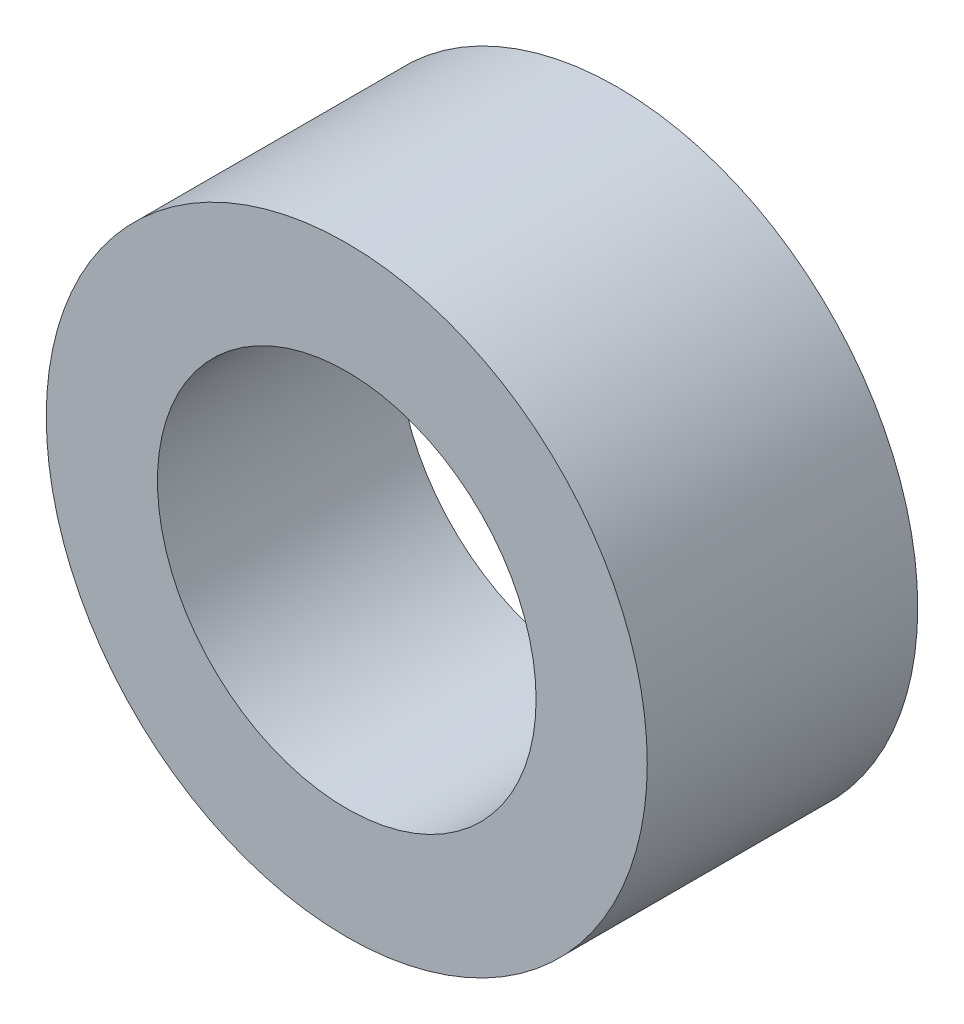
from build123d import *

# Parameters (mm, degrees)
SKETCH1_R          = 10
EXTRUDE1_DEPTH     = 8
EXTRUDE2_START     = 1
SKETCH3_R          = 10
SKETCH3_R_2        = 9
EXTRUDE2_DEPTH     = 1
SKETCH2_R          = 6.3
CUT_EXTRUDE1_DEPTH = 17.763054614


with BuildPart() as part:
    # Sketch1 → Extrude1 (new body)
    with BuildSketch(Plane.XY):
        Circle(SKETCH1_R)
    extrude(amount=EXTRUDE1_DEPTH)

    # Sketch3 → Extrude2 (add)
    with BuildSketch(Plane(origin=(0, 0, 0), x_dir=(-1, 0, 0), z_dir=(0, 0, -1)).offset(EXTRUDE2_START)):
        Circle(SKETCH3_R)
        Circle(SKETCH3_R_2, mode=Mode.SUBTRACT)
    extrude(amount=-EXTRUDE2_DEPTH)

    # Sketch2 → Cut-Extrude1 (cut, through all)
    with BuildSketch(Plane.XY.offset(8)):
        Circle(SKETCH2_R)
    extrude(amount=-CUT_EXTRUDE1_DEPTH, mode=Mode.SUBTRACT)


solid = part.part
